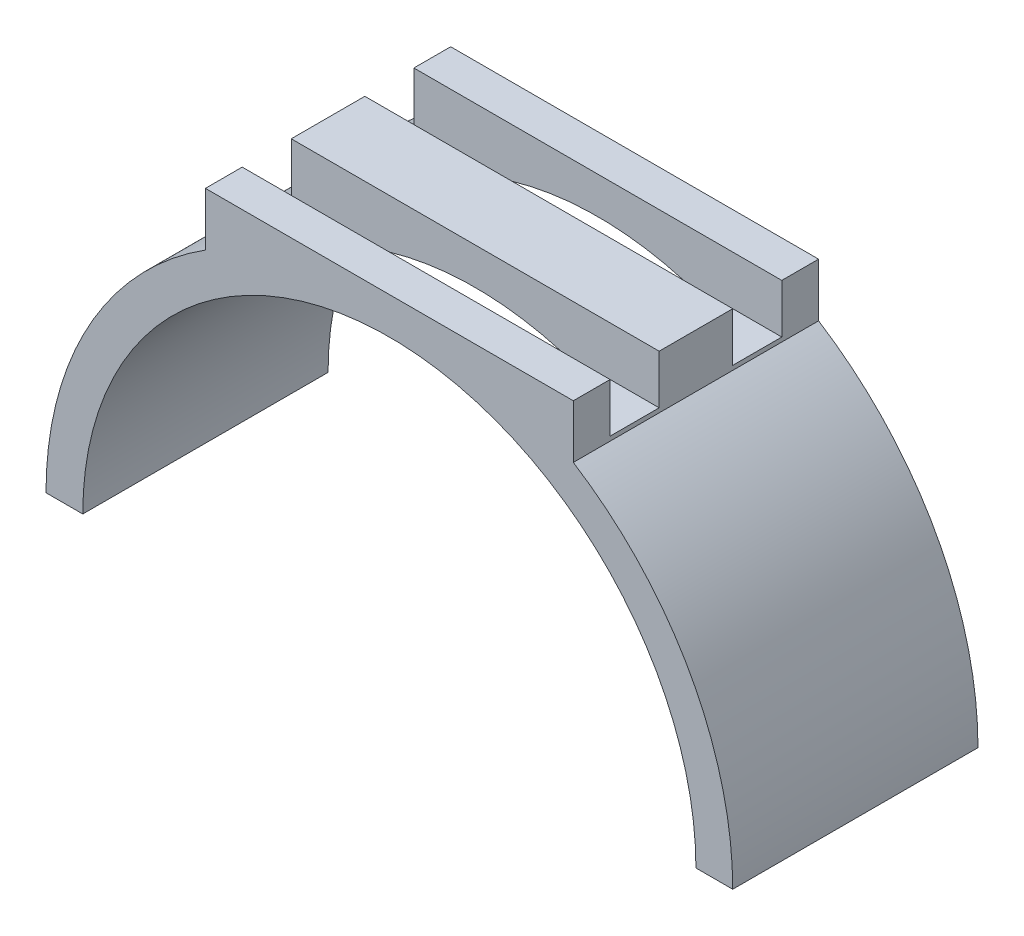
from build123d import *

# Parameters (mm, degrees)
SALIENTE_EXTRUIR1_DEPTH = 20
SALIENTE_EXTRUIR2_DEPTH = 20
CROQUIS3_W              = 30
CROQUIS3_H              = 4
CORTAR_EXTRUIR1_DEPTH   = 4


with BuildPart() as part:
    # Croquis1 → Saliente-Extruir1 (new body)
    with BuildSketch(Plane.XY):
        with BuildLine():
            Line((-28, 0), (-25, 0))
            ThreePointArc((-25, 0), (0, 25), (25, 0))
            Line((25, 0), (28, 0))
            ThreePointArc((28, 0), (0, 28), (-28, 0))
        make_face()
    extrude(amount=SALIENTE_EXTRUIR1_DEPTH)

    # Croquis2 → Saliente-Extruir2 (add)
    with BuildSketch(Plane.XY.offset(20)):
        Polygon((0, 28), (15, 28), (15, 22.565689598), (0, 26.315842258), (-15, 21.969074402), (-15, 28), align=None)
    extrude(amount=-SALIENTE_EXTRUIR2_DEPTH)

    # Croquis3 → Cortar-Extruir1 (cut)
    with BuildSketch(Plane(origin=(0, 28, 0), x_dir=(1, 0, 0), z_dir=(0, 1, 0))):
        with Locations((0, -15)):
            Rectangle(CROQUIS3_W, CROQUIS3_H)
        with Locations((0, -5)):
            Rectangle(CROQUIS3_W, CROQUIS3_H)
    extrude(amount=-CORTAR_EXTRUIR1_DEPTH, mode=Mode.SUBTRACT)


solid = part.part
